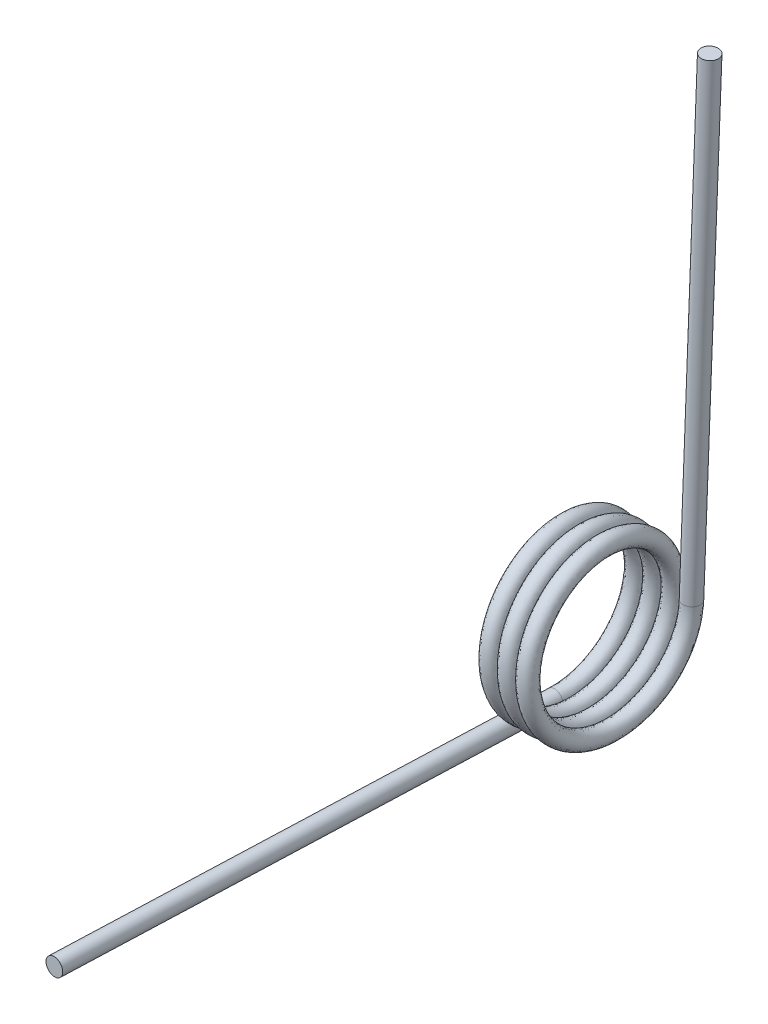
from build123d import *

# Parameters (mm, degrees)
SWEEP1_PITCH       = 0.4826
SWEEP1_HEIGHT      = 1.56845
SWEEP1_RADIUS      = 2.032
SWEEP1_START_ANGLE = 90
SKETCH2_R          = 0.2286
SKETCH3_R          = 0.2286
EXTRUDE1_DEPTH     = 12.7
SKETCH4_R          = 0.2286
EXTRUDE2_DEPTH     = 12.7


with BuildPart() as part:
    # Sweep1: sweep along a helix
    with BuildLine() as sweep1_path:
        add(Helix(SWEEP1_PITCH, SWEEP1_HEIGHT, SWEEP1_RADIUS, center=(0, 0, 0), direction=(1, 0, 0), mode=Mode.PRIVATE).rotate(Axis((0, 0, 0), (1, 0, 0)), SWEEP1_START_ANGLE))
    # Sketch2 → Sweep1 (sweep)
    with BuildSketch(Plane(origin=(0, -2.032, 0), x_dir=(0.9952969691308517, 0.08926681293390744, 0.037621527714370634), z_dir=(0.03777232431311158, 1.1261824806041432e-14, -0.999286371124907))):
        Circle(SKETCH2_R)
    sweep(path=sweep1_path.line, is_frenet=True)

    # Sketch3 → Extrude1 (add)
    with BuildSketch(Plane(origin=(0, 0, 0), x_dir=(-0.9952969691308517, -0.08926681293390744, -0.03762152771437064), z_dir=(-0.03777232431311159, -1.1263993210386403e-14, 0.999286371124907))):
        with Locations(Location((0.181390164, 2.023887746, 0), (0, 0, 354.87857121))):
            Circle(SKETCH3_R)
    extrude(amount=EXTRUDE1_DEPTH)

    # Sketch4 → Extrude2 (add)
    with BuildSketch(Plane(origin=(0.002237784, 0.059201724, 0), x_dir=(0.9952969691308529, -0.037621527714364764, -0.08926681293389803), z_dir=(0.03777232431311158, 0.999286371124907, 5.4844150054744745e-14))):
        with Locations(Location((1.742463695, 1.883977129, 0), (0, 0, 174.87857121))):
            Circle(SKETCH4_R)
    extrude(amount=EXTRUDE2_DEPTH)


solid = part.part
